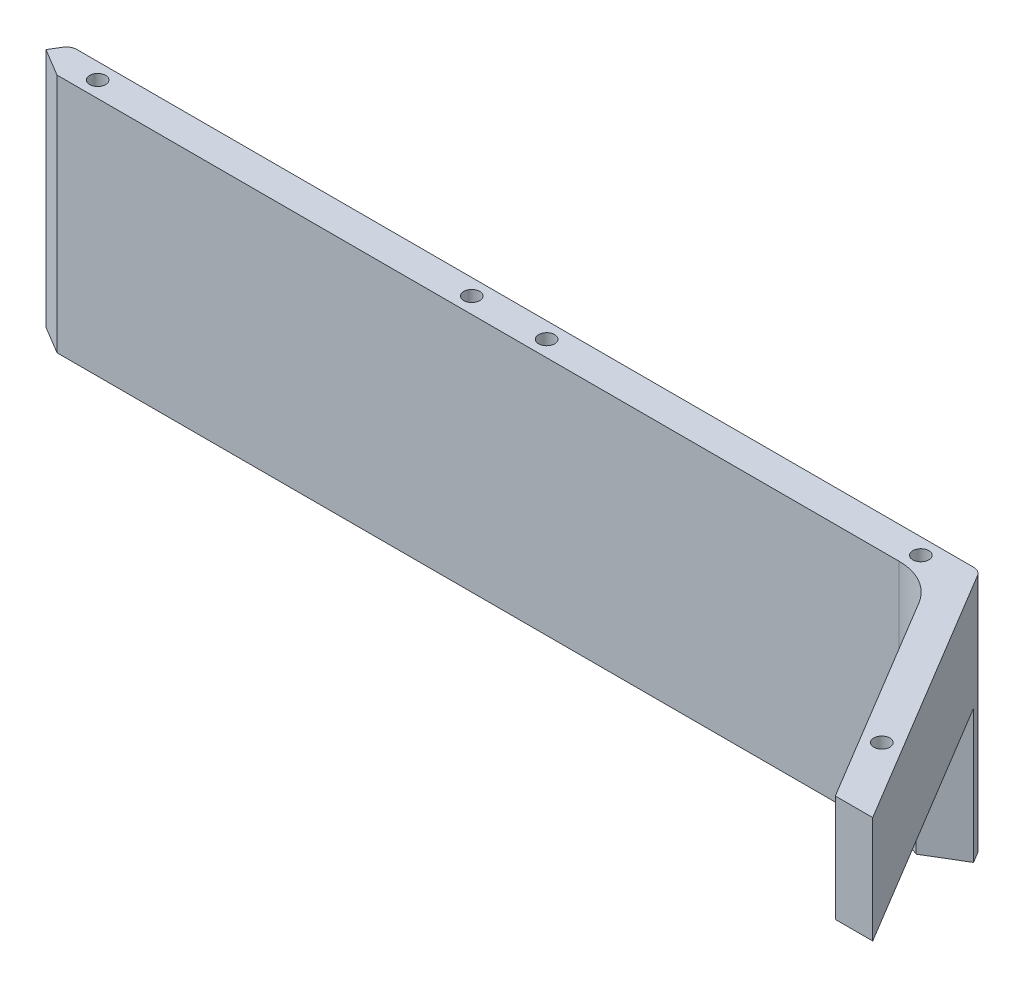
from build123d import *

# Parameters (mm, degrees)
BOSS_EXTRUDE1_DEPTH = 22.5
SKETCH2_R           = 1.5
CUT_EXTRUDE1_DEPTH  = 5
FILLET1_R           = 2
SKETCH4_W           = 55
SKETCH4_H           = 25
CUT_EXTRUDE3_DEPTH  = 10
SKETCH5_W           = 5
SKETCH5_H           = 5
CUT_EXTRUDE4_DEPTH  = 10
SKETCH6_W           = 60
SKETCH6_H           = 45
CUT_EXTRUDE5_DEPTH  = 10
FILLET2_R           = 10


with BuildPart() as part:
    # Sketch1 → Boss-Extrude1 (new, symmetric)
    with BuildSketch(Plane(origin=(0, 0, 0), x_dir=(1, 0, 0), z_dir=(0, 1, 0))):
        Polygon((-115, 0), (-85, 50), (85, 50), (115, 0), (108, 0), (81.6, 44), (-81.6, 44), (-108, 0), align=None)
    extrude(amount=BOSS_EXTRUDE1_DEPTH, both=True)

    # Sketch2 → Cut-Extrude1 (cut)
    with BuildSketch(Plane(origin=(0, 22.5, 0), x_dir=(1, 0, 0), z_dir=(0, 1, 0))):
        with Locations(Location((-103.701428863, 13, 0), (0, 0, 270))):
            Circle(SKETCH2_R)
        with Locations(Location((-77, 47, 0), (0, 0, 270))):
            Circle(SKETCH2_R)
        with Locations(Location((-7, 47, 0), (0, 0, 270))):
            Circle(SKETCH2_R)
        with Locations(Location((7, 47, 0), (0, 0, 90))):
            Circle(SKETCH2_R)
        with Locations(Location((77, 47, 0), (0, 0, 90))):
            Circle(SKETCH2_R)
        with Locations(Location((103.701428863, 13, 0), (0, 0, 90))):
            Circle(SKETCH2_R)
    extrude(amount=-CUT_EXTRUDE1_DEPTH, mode=Mode.SUBTRACT)

    # Fillet1
    fillet1_edges = [part.edges().sort_by_distance(p)[0] for p in [
        (-85, 0, -50),
        (85, 0, -50),
    ]]
    fillet(fillet1_edges, radius=FILLET1_R)

    # Sketch4 → Cut-Extrude3 (cut)
    with BuildSketch(Plane(origin=(84.558823529, 0, -50.735294118), x_dir=(-0.5144957554275265, 0, -0.8574929257125443), z_dir=(0.8574929257125443, 0, -0.5144957554275265))):
        with Locations((-31.667011874, -10)):
            Rectangle(SKETCH4_W, SKETCH4_H)
    extrude(amount=-CUT_EXTRUDE3_DEPTH, mode=Mode.SUBTRACT)

    # Sketch5 → Cut-Extrude4 (cut)
    with BuildSketch(Plane(origin=(-79.411764706, 0, -47.647058824), x_dir=(0.5144957554275261, 0, -0.8574929257125445), z_dir=(0.8574929257125444, 0, 0.514495755427526))):
        with Locations((-56.667011874, -20)):
            Rectangle(SKETCH5_W, SKETCH5_H)
    extrude(amount=-CUT_EXTRUDE4_DEPTH, mode=Mode.SUBTRACT)

    # Sketch6 → Cut-Extrude5 (cut)
    with BuildSketch(Plane(origin=(-79.411764706, 0, -47.647058824), x_dir=(0.5144957554275261, 0, -0.8574929257125445), z_dir=(0.8574929257125444, 0, 0.514495755427526))):
        with Locations((-34.253164912, 0)):
            Rectangle(SKETCH6_W, SKETCH6_H)
    extrude(amount=-CUT_EXTRUDE5_DEPTH, mode=Mode.SUBTRACT)

    # Fillet2
    fillet2_edges = [part.edges().sort_by_distance(p)[0] for p in [
        (81.6, 12.5, -44),
    ]]
    fillet(fillet2_edges, radius=FILLET2_R)


solid = part.part
